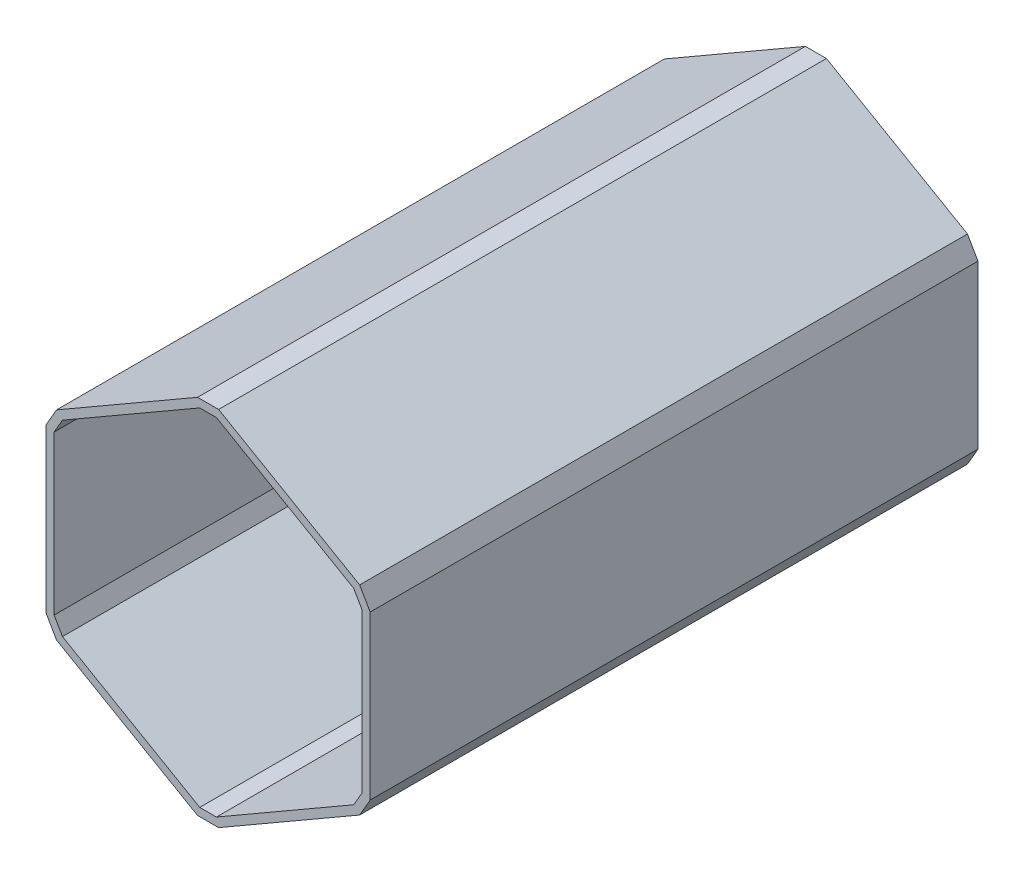
from build123d import *

# Parameters (mm, degrees)
EXTRUDE_1_DEPTH = 150


with BuildPart() as part:
    # Эскиз1 → Бобышка-Вытянуть1 (new body)
    with BuildSketch(Plane.XY):
        Polygon((2.598076211, 44.688021535), (-2.598076211, 44.688021535), (-37.401923789, 24.594010768), (-40, 20.094010768), (-40, -20.094010768), (-37.401923789, -24.594010768), (-2.598076211, -44.688021535), (2.598076211, -44.688021535), (37.401923789, -24.594010768), (40, -20.094010768), (40, 20.094010768), (37.401923789, 24.594010768), align=None)
        Polygon((-2.062177826, 42.688021535), (-35.937822174, 23.129909152), (-38, 19.558112383), (-38, -19.558112383), (-35.937822174, -23.129909152), (-2.062177826, -42.688021535), (2.062177826, -42.688021535), (35.937822174, -23.129909152), (38, -19.558112383), (38, 19.558112383), (35.937822174, 23.129909152), (2.062177826, 42.688021535), align=None, mode=Mode.SUBTRACT)
    extrude(amount=EXTRUDE_1_DEPTH)


solid = part.part
